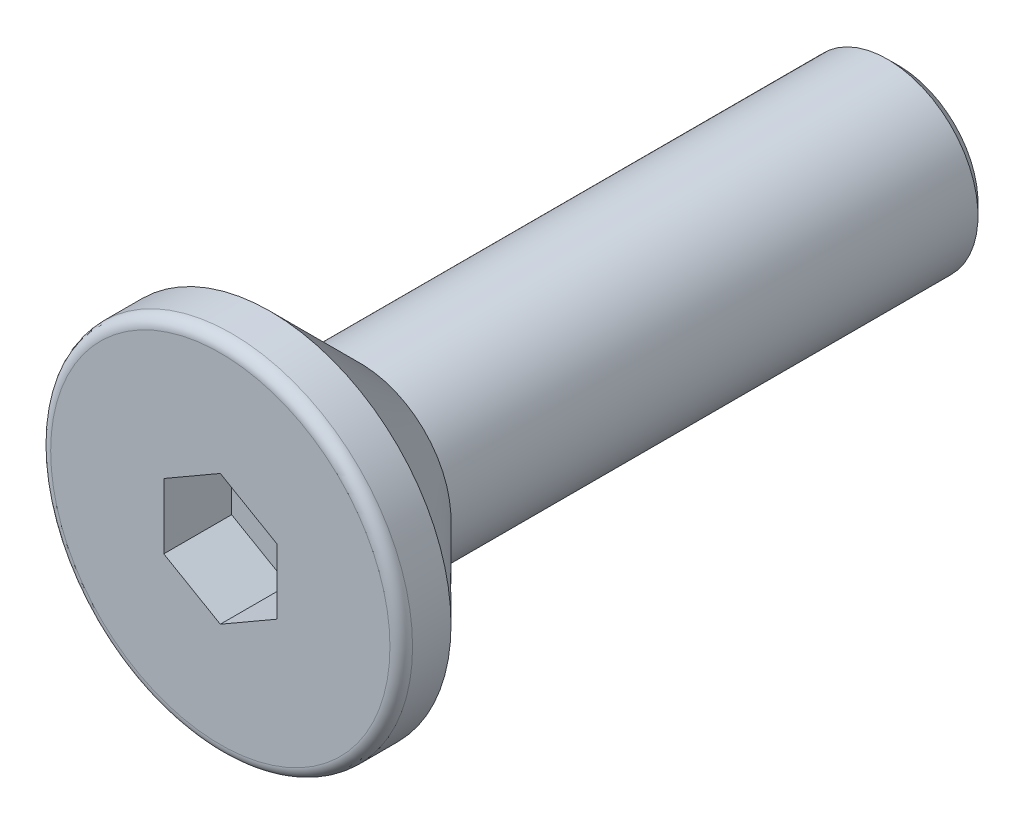
from build123d import *

# Parameters (mm, degrees)
CUT_EXTRUDE_1_DEPTH = 3
FILLET_1_R          = 0.5
CHAMFER_1_SIZE      = 0.5


with BuildPart() as part:
    # 草图1 → 旋转1 (revolve)
    with BuildSketch(Plane(origin=(0, 0, 0), x_dir=(0, 0, -1), z_dir=(1, 0, 0)), mode=Mode.PRIVATE) as revolve_1_sk:
        Polygon((-15, 0), (-15, 8), (-12.8, 8), (-8.8, 4), (15, 4), (15, 0), align=None)
    revolve(revolve_1_sk.sketch.rotate(Axis((0, 0, -15), (0, 0, 1)), 90), axis=Axis((0, 0, -15), (0, 0, 1)))

    # 草图2 → 切除-拉伸1 (cut)
    with BuildSketch(Plane.XY.offset(15)):
        Polygon((0, 2.886751346), (-2.5, 1.443375673), (-2.5, -1.443375673), (0, -2.886751346), (2.5, -1.443375673), (2.5, 1.443375673), align=None)
    extrude(amount=-CUT_EXTRUDE_1_DEPTH, mode=Mode.SUBTRACT)

    # 圆角1
    fillet_1_edges = [part.edges().sort_by_distance(p)[0] for p in [
        (8, 0, 15),
    ]]
    fillet(fillet_1_edges, radius=FILLET_1_R)

    # 倒角1
    chamfer_1_edges = [part.edges().sort_by_distance(p)[0] for p in [
        (4, 0, -15),
    ]]
    chamfer(chamfer_1_edges, length=CHAMFER_1_SIZE)


solid = part.part
